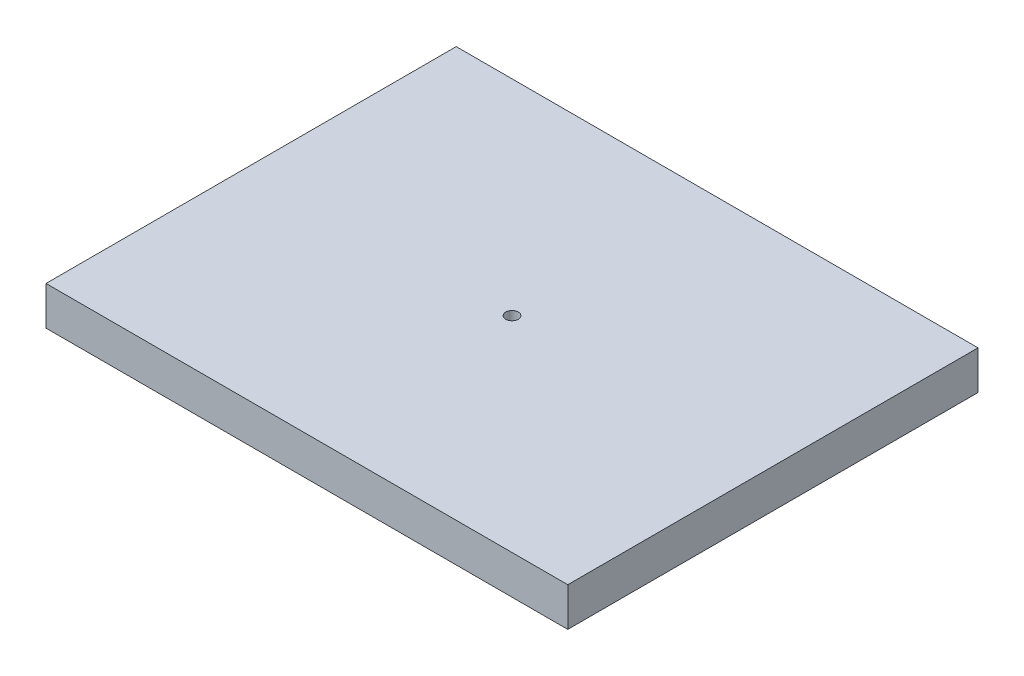
from build123d import *

# Parameters (mm, degrees)
SKETCH1_W                   = 136.90876716
SKETCH1_H                   = 107.642037948
BOSS_EXTRUDE1_DEPTH         = 10.16
TAP_DRILL_FOR_M4X0_7_TAP1_D = 3.3


with BuildPart() as part:
    # Sketch1 → Boss-Extrude1 (new body)
    with BuildSketch(Plane(origin=(0, 0, 0), x_dir=(1, 0, 0), z_dir=(0, 1, 0))):
        Rectangle(SKETCH1_W, SKETCH1_H)
    extrude(amount=BOSS_EXTRUDE1_DEPTH)

    # Tap Drill for M4x0.7 Tap1 (through all)
    with Locations(Plane(origin=(0, 10.16, 0), x_dir=(1, 0, 0), z_dir=(0, 1, 0))):
        with Locations((0, 0)):
            Hole(TAP_DRILL_FOR_M4X0_7_TAP1_D / 2)


solid = part.part
